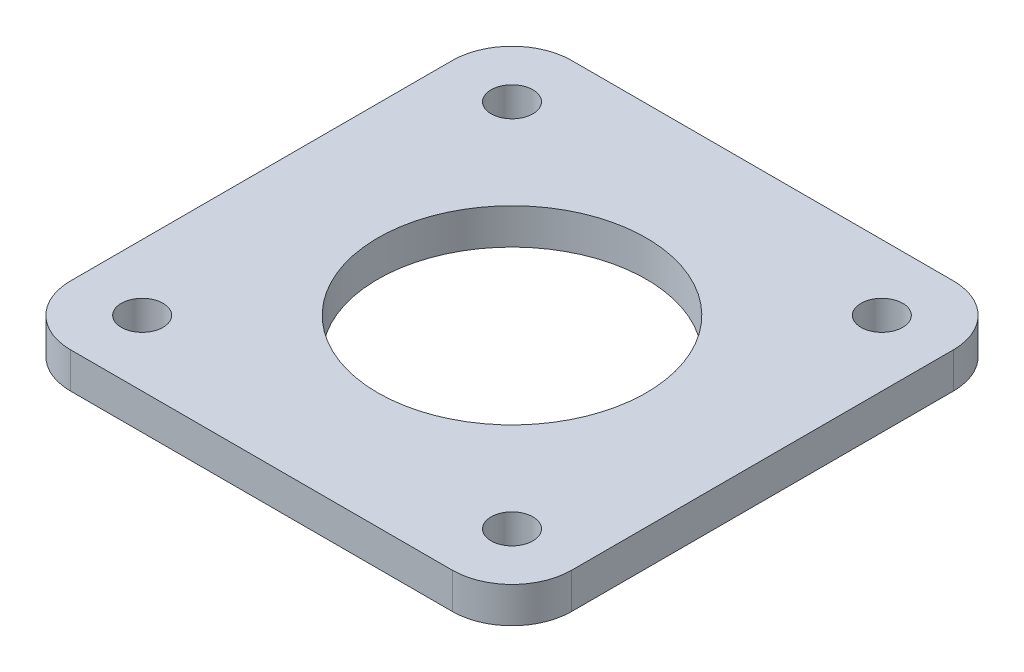
from build123d import *

# Parameters (mm, degrees)
SKETCH1_W           = 42
SKETCH1_H           = 42
BOSS_EXTRUDE1_DEPTH = 3
SKETCH2_R           = 1.75
SKETCH2_R_2         = 11.25
CUT_EXTRUDE1_DEPTH  = 30.849623113
FILLET1_R           = 5


with BuildPart() as part:
    # Sketch1 → Boss-Extrude1 (new body)
    with BuildSketch(Plane(origin=(0, 0, 0), x_dir=(1, 0, 0), z_dir=(0, 1, 0))):
        Rectangle(SKETCH1_W, SKETCH1_H)
    extrude(amount=BOSS_EXTRUDE1_DEPTH)

    # Sketch2 → Cut-Extrude1 (cut, through all)
    with BuildSketch(Plane(origin=(0, 3, 0), x_dir=(1, 0, 0), z_dir=(0, 1, 0))):
        with Locations(Location((-15.5, 15.5, 0), (0, 0, 270))):
            Circle(SKETCH2_R)
        with Locations(Location((15.5, 15.5, 0), (0, 0, 270))):
            Circle(SKETCH2_R)
        with Locations(Location((15.5, -15.5, 0), (0, 0, 270))):
            Circle(SKETCH2_R)
        with Locations(Location((-15.5, -15.5, 0), (0, 0, 270))):
            Circle(SKETCH2_R)
        with Locations(Location((0, 0, 0), (0, 0, 270))):
            Circle(SKETCH2_R_2)
    extrude(amount=-CUT_EXTRUDE1_DEPTH, mode=Mode.SUBTRACT)

    # Fillet1
    fillet1_edges = [part.edges().sort_by_distance(p)[0] for p in [
        (21, 1.5, 21),
        (-21, 1.5, 21),
        (-21, 1.5, -21),
        (21, 1.5, -21),
    ]]
    fillet(fillet1_edges, radius=FILLET1_R)


solid = part.part
